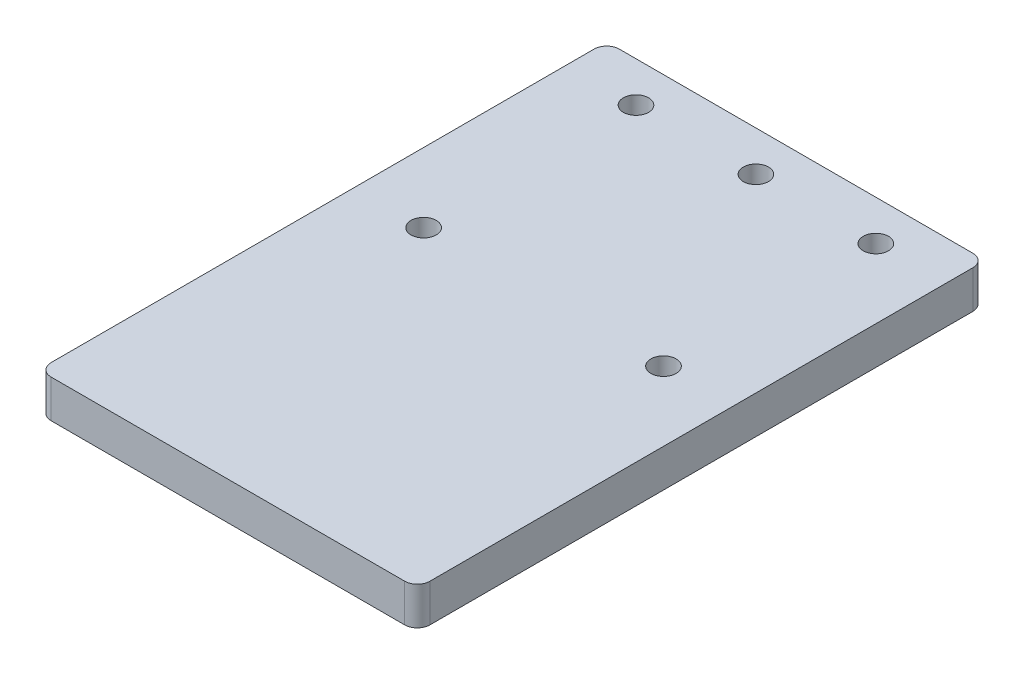
from build123d import *

# Parameters (mm, degrees)
SKETCH1_W           = 30
SKETCH1_H           = 45
SKETCH1_R           = 1
BOSS_EXTRUDE1_DEPTH = 3
FILLET1_R           = 1


with BuildPart() as part:
    # Sketch1 → Boss-Extrude1 (new body)
    with BuildSketch(Plane(origin=(0, 0, 0), x_dir=(1, 0, 0), z_dir=(0, 1, 0))):
        with Locations((15, -22.5)):
            Rectangle(SKETCH1_W, SKETCH1_H)
        with Locations(Location((15, -3.18, 0), (0, 0, 270))):
            Circle(SKETCH1_R, mode=Mode.SUBTRACT)
        with Locations(Location((5.5, -20, 0), (0, 0, 270))):
            Circle(SKETCH1_R, mode=Mode.SUBTRACT)
        with Locations(Location((24.5, -20, 0), (0, 0, 270))):
            Circle(SKETCH1_R, mode=Mode.SUBTRACT)
        with Locations(Location((24.5, -3.18, 0), (0, 0, 270))):
            Circle(SKETCH1_R, mode=Mode.SUBTRACT)
        with Locations(Location((5.5, -3.18, 0), (0, 0, 270))):
            Circle(SKETCH1_R, mode=Mode.SUBTRACT)
    extrude(amount=BOSS_EXTRUDE1_DEPTH)

    # Fillet1
    fillet1_edges = [part.edges().sort_by_distance(p)[0] for p in [
        (0, 1.5, 0),
        (30, 1.5, 0),
        (30, 1.5, 45),
        (0, 1.5, 45),
    ]]
    fillet(fillet1_edges, radius=FILLET1_R)


solid = part.part
